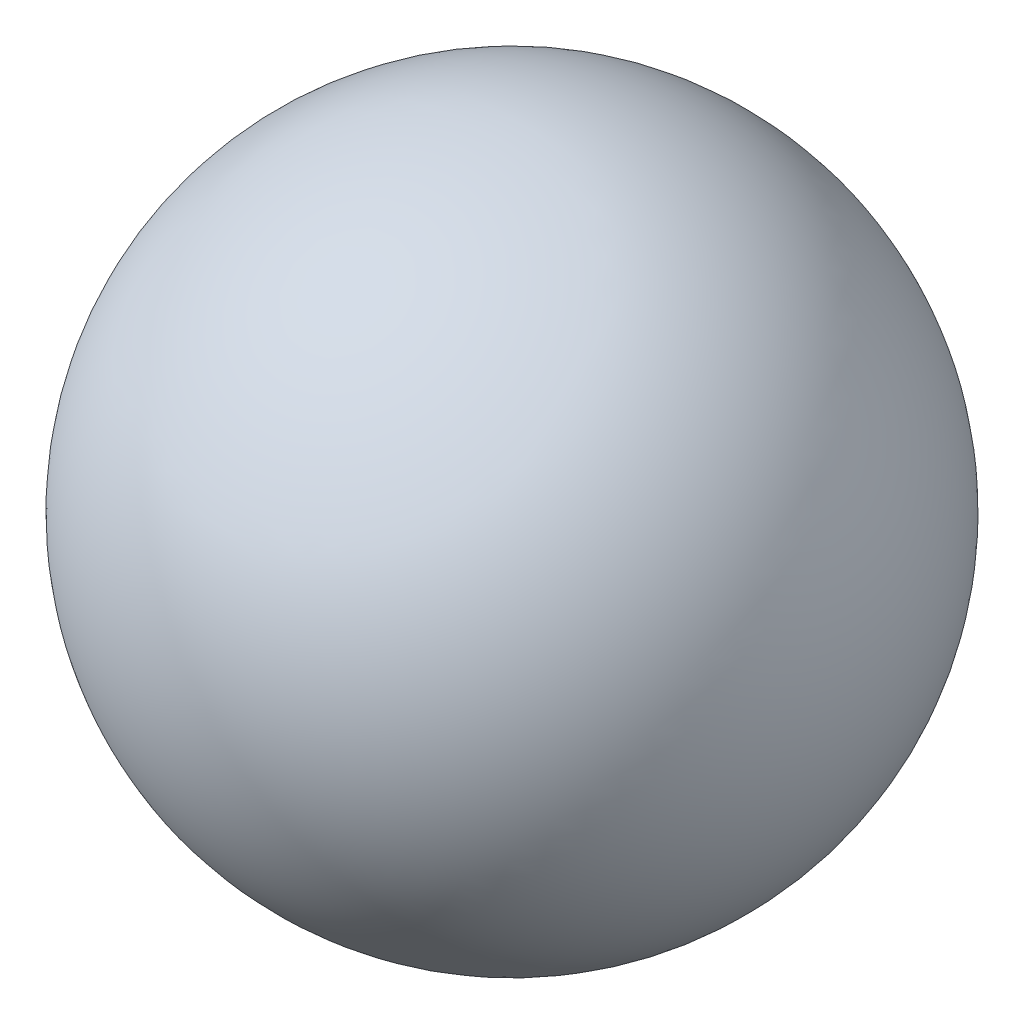
from build123d import *


with BuildPart() as part:
    # Sketch1 → Revolve1 (revolve)
    with BuildSketch(Plane(origin=(0, 0, 0), x_dir=(1, 0, 0), z_dir=(0, 1, 0))):
        with BuildLine():
            Line((0, 110), (0, 105))
            ThreePointArc((0, 105), (105, 0), (0, -105))
            Line((0, -105), (0, -110))
            ThreePointArc((0, -110), (110, 0), (0, 110))
        make_face()
    revolve(axis=Axis((0, 0, -110), (0, 0, 1)))


solid = part.part
